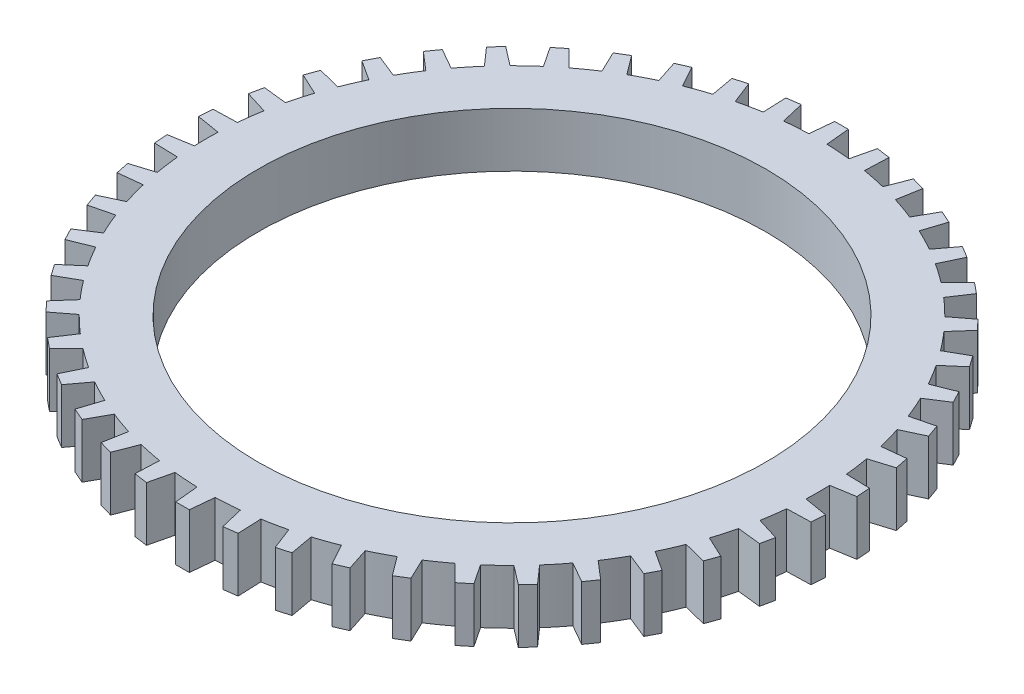
from build123d import *

# Parameters (mm, degrees)
CROQUIS1_R              = 14
SALIENTE_EXTRUIR1_DEPTH = 3


with BuildPart() as part:
    # Croquis1 → Saliente-Extruir1 (new body)
    with BuildSketch(Plane(origin=(0, 0, 0), x_dir=(1, 0, 0), z_dir=(0, 1, 0))):
        with BuildLine():
            Line((-0.5, 16.868356129), (-0.375, 18.168356129))
            Line((-0.375, 18.168356129), (0.375, 18.168356129))
            Line((0.375, 18.168356129), (0.5, 16.868356129))
            ThreePointArc((0.5, 16.868356129), (1.151642919, 16.836423524), (1.801564557, 16.779326674))
            Line((1.801564557, 16.779326674), (2.102416944, 18.050197573))
            Line((2.102416944, 18.050197573), (2.845431403, 17.948072586))
            Line((2.845431403, 17.948072586), (2.792250503, 16.643160025))
            ThreePointArc((2.792250503, 16.643160025), (3.433475829, 16.52279281), (4.069569375, 16.377730111))
            Line((4.069569375, 16.377730111), (4.540669838, 17.595797989))
            Line((4.540669838, 17.595797989), (5.262857804, 17.39345041))
            Line((5.262857804, 17.39345041), (5.032486662, 16.10793334))
            ThreePointArc((5.032486662, 16.10793334), (5.65134958, 15.901373727), (6.261765815, 15.671047424))
            Line((6.261765815, 15.671047424), (6.894338644, 16.81362198))
            Line((6.894338644, 16.81362198), (7.582247121, 16.514821163))
            Line((7.582247121, 16.514821163), (7.178977116, 15.272646334))
            ThreePointArc((7.178977116, 15.272646334), (7.763949382, 14.983742139), (8.337317406, 14.672442774))
            Line((8.337317406, 14.672442774), (9.119578966, 15.718240007))
            Line((9.119578966, 15.718240007), (9.76039352, 15.328552044))
            Line((9.76039352, 15.328552044), (9.19173681, 14.152858824))
            ThreePointArc((9.19173681, 14.152858824), (9.731921496, 13.786991785), (10.257560548, 13.400518277))
            Line((10.257560548, 13.400518277), (11.174938787, 14.330056962))
            Line((11.174938787, 14.330056962), (11.756722255, 13.856741004))
            Line((11.756722255, 13.856741004), (11.033271839, 12.769430333))
            ThreePointArc((11.033271839, 12.769430333), (11.518606327, 12.33341586), (11.986724746, 11.878967479))
            Line((11.986724746, 11.878967479), (13.022130642, 12.67493207))
            Line((13.022130642, 12.67493207), (13.5340455, 12.126805096))
            Line((13.5340455, 12.126805096), (12.669277889, 11.148131515))
            ThreePointArc((12.669277889, 11.148131515), (13.090721316, 10.650091734), (13.492598941, 10.136133993))
            Line((13.492598941, 10.136133993), (14.626744842, 10.783697175))
            Line((14.626744842, 10.783697175), (15.059255084, 10.170969755))
            Line((15.059255084, 10.170969755), (14.069279263, 9.3191641))
            ThreePointArc((14.069279263, 9.3191641), (14.418980935, 8.768376549), (14.747131547, 8.204483508))
            Line((14.747131547, 8.204483508), (15.958890461, 8.691582405))
            Line((15.958890461, 8.691582405), (16.303939239, 8.025668491))
            Line((16.303939239, 8.025668491), (15.207196585, 7.31659829))
            ThreePointArc((15.207196585, 7.31659829), (15.478642221, 6.723323099), (15.726952995, 6.11999902))
            Line((15.726952995, 6.11999902), (16.993752145, 6.4375599))
            Line((16.993752145, 6.4375599), (17.244911854, 5.730864208))
            Line((17.244911854, 5.730864208), (16.061832607, 5.177738097))
            ThreePointArc((16.061832607, 5.177738097), (16.249965689, 4.553026861), (16.413811065, 3.921510529))
            Line((16.413811065, 3.921510529), (17.71205238, 4.063617835))
            Line((17.71205238, 4.063617835), (17.86464439, 3.329304769))
            Line((17.86464439, 3.329304769), (16.617267078, 2.942426441))
            ThreePointArc((16.617267078, 2.942426441), (16.718583043, 2.297916347), (16.794910891, 1.649971716))
            Line((16.794910891, 1.649971716), (18.100410592, 1.613978258))
            Line((18.100410592, 1.613978258), (18.151592403, 0.865726681))
            Line((18.151592403, 0.865726681), (16.863153304, 0.652302947))
            ThreePointArc((16.863153304, 0.652302947), (16.875764827, 0), (16.863153304, -0.652302947))
            Line((16.863153304, -0.652302947), (18.151592403, -0.865726681))
            Line((18.151592403, -0.865726681), (18.100410592, -1.613978258))
            Line((18.100410592, -1.613978258), (16.794910891, -1.649971716))
            ThreePointArc((16.794910891, -1.649971716), (16.718583043, -2.297916347), (16.617267078, -2.942426441))
            Line((16.617267078, -2.942426441), (17.86464439, -3.329304769))
            Line((17.86464439, -3.329304769), (17.71205238, -4.063617835))
            Line((17.71205238, -4.063617835), (16.413811065, -3.921510529))
            ThreePointArc((16.413811065, -3.921510529), (16.249965689, -4.553026861), (16.061832607, -5.177738097))
            Line((16.061832607, -5.177738097), (17.244911854, -5.730864208))
            Line((17.244911854, -5.730864208), (16.993752145, -6.4375599))
            Line((16.993752145, -6.4375599), (15.726952995, -6.11999902))
            ThreePointArc((15.726952995, -6.11999902), (15.478642221, -6.723323099), (15.207196585, -7.31659829))
            Line((15.207196585, -7.31659829), (16.303939239, -8.025668491))
            Line((16.303939239, -8.025668491), (15.958890461, -8.691582405))
            Line((15.958890461, -8.691582405), (14.747131547, -8.204483508))
            ThreePointArc((14.747131547, -8.204483508), (14.418980935, -8.768376549), (14.069279263, -9.3191641))
            Line((14.069279263, -9.3191641), (15.059255084, -10.170969755))
            Line((15.059255084, -10.170969755), (14.626744842, -10.783697175))
            Line((14.626744842, -10.783697175), (13.492598941, -10.136133993))
            ThreePointArc((13.492598941, -10.136133993), (13.090721316, -10.650091734), (12.669277889, -11.148131515))
            Line((12.669277889, -11.148131515), (13.5340455, -12.126805096))
            Line((13.5340455, -12.126805096), (13.022130642, -12.67493207))
            Line((13.022130642, -12.67493207), (11.986724746, -11.878967479))
            ThreePointArc((11.986724746, -11.878967479), (11.518606327, -12.33341586), (11.033271839, -12.769430333))
            Line((11.033271839, -12.769430333), (11.756722255, -13.856741004))
            Line((11.756722255, -13.856741004), (11.174938787, -14.330056962))
            Line((11.174938787, -14.330056962), (10.257560548, -13.400518277))
            ThreePointArc((10.257560548, -13.400518277), (9.731921496, -13.786991785), (9.19173681, -14.152858824))
            Line((9.19173681, -14.152858824), (9.76039352, -15.328552044))
            Line((9.76039352, -15.328552044), (9.119578966, -15.718240007))
            Line((9.119578966, -15.718240007), (8.337317406, -14.672442774))
            ThreePointArc((8.337317406, -14.672442774), (7.763949382, -14.983742139), (7.178977116, -15.272646334))
            Line((7.178977116, -15.272646334), (7.582247121, -16.514821163))
            Line((7.582247121, -16.514821163), (6.894338644, -16.81362198))
            Line((6.894338644, -16.81362198), (6.261765815, -15.671047424))
            ThreePointArc((6.261765815, -15.671047424), (5.65134958, -15.901373727), (5.032486662, -16.10793334))
            Line((5.032486662, -16.10793334), (5.262857804, -17.39345041))
            Line((5.262857804, -17.39345041), (4.540669838, -17.595797989))
            Line((4.540669838, -17.595797989), (4.069569375, -16.377730111))
            ThreePointArc((4.069569375, -16.377730111), (3.433475829, -16.52279281), (2.792250503, -16.643160025))
            Line((2.792250503, -16.643160025), (2.845431403, -17.948072586))
            Line((2.845431403, -17.948072586), (2.102416944, -18.050197573))
            Line((2.102416944, -18.050197573), (1.801564557, -16.779326674))
            ThreePointArc((1.801564557, -16.779326674), (1.151642919, -16.836423524), (0.5, -16.868356129))
            Line((0.5, -16.868356129), (0.375, -18.168356129))
            Line((0.375, -18.168356129), (-0.375, -18.168356129))
            Line((-0.375, -18.168356129), (-0.5, -16.868356129))
            ThreePointArc((-0.5, -16.868356129), (-1.151642919, -16.836423524), (-1.801564557, -16.779326674))
            Line((-1.801564557, -16.779326674), (-2.102416944, -18.050197573))
            Line((-2.102416944, -18.050197573), (-2.845431403, -17.948072586))
            Line((-2.845431403, -17.948072586), (-2.792250503, -16.643160025))
            ThreePointArc((-2.792250503, -16.643160025), (-3.433475829, -16.52279281), (-4.069569375, -16.377730111))
            Line((-4.069569375, -16.377730111), (-4.540669838, -17.595797989))
            Line((-4.540669838, -17.595797989), (-5.262857804, -17.39345041))
            Line((-5.262857804, -17.39345041), (-5.032486662, -16.10793334))
            ThreePointArc((-5.032486662, -16.10793334), (-5.65134958, -15.901373727), (-6.261765815, -15.671047424))
            Line((-6.261765815, -15.671047424), (-6.894338644, -16.81362198))
            Line((-6.894338644, -16.81362198), (-7.582247121, -16.514821163))
            Line((-7.582247121, -16.514821163), (-7.178977116, -15.272646334))
            ThreePointArc((-7.178977116, -15.272646334), (-7.763949382, -14.983742139), (-8.337317406, -14.672442774))
            Line((-8.337317406, -14.672442774), (-9.119578966, -15.718240007))
            Line((-9.119578966, -15.718240007), (-9.76039352, -15.328552044))
            Line((-9.76039352, -15.328552044), (-9.19173681, -14.152858824))
            ThreePointArc((-9.19173681, -14.152858824), (-9.731921496, -13.786991785), (-10.257560548, -13.400518277))
            Line((-10.257560548, -13.400518277), (-11.174938787, -14.330056962))
            Line((-11.174938787, -14.330056962), (-11.756722255, -13.856741004))
            Line((-11.756722255, -13.856741004), (-11.033271839, -12.769430333))
            ThreePointArc((-11.033271839, -12.769430333), (-11.518606327, -12.33341586), (-11.986724746, -11.878967479))
            Line((-11.986724746, -11.878967479), (-13.022130642, -12.67493207))
            Line((-13.022130642, -12.67493207), (-13.5340455, -12.126805096))
            Line((-13.5340455, -12.126805096), (-12.669277889, -11.148131515))
            ThreePointArc((-12.669277889, -11.148131515), (-13.090721316, -10.650091734), (-13.492598941, -10.136133993))
            Line((-13.492598941, -10.136133993), (-14.626744842, -10.783697175))
            Line((-14.626744842, -10.783697175), (-15.059255084, -10.170969755))
            Line((-15.059255084, -10.170969755), (-14.069279263, -9.3191641))
            ThreePointArc((-14.069279263, -9.3191641), (-14.418980935, -8.768376549), (-14.747131547, -8.204483508))
            Line((-14.747131547, -8.204483508), (-15.958890461, -8.691582405))
            Line((-15.958890461, -8.691582405), (-16.303939239, -8.025668491))
            Line((-16.303939239, -8.025668491), (-15.207196585, -7.31659829))
            ThreePointArc((-15.207196585, -7.31659829), (-15.478642221, -6.723323099), (-15.726952995, -6.11999902))
            Line((-15.726952995, -6.11999902), (-16.993752145, -6.4375599))
            Line((-16.993752145, -6.4375599), (-17.244911854, -5.730864208))
            Line((-17.244911854, -5.730864208), (-16.061832607, -5.177738097))
            ThreePointArc((-16.061832607, -5.177738097), (-16.249965689, -4.553026861), (-16.413811065, -3.921510529))
            Line((-16.413811065, -3.921510529), (-17.71205238, -4.063617835))
            Line((-17.71205238, -4.063617835), (-17.86464439, -3.329304769))
            Line((-17.86464439, -3.329304769), (-16.617267078, -2.942426441))
            ThreePointArc((-16.617267078, -2.942426441), (-16.718583043, -2.297916347), (-16.794910891, -1.649971716))
            Line((-16.794910891, -1.649971716), (-18.100410592, -1.613978258))
            Line((-18.100410592, -1.613978258), (-18.151592403, -0.865726681))
            Line((-18.151592403, -0.865726681), (-16.863153304, -0.652302947))
            ThreePointArc((-16.863153304, -0.652302947), (-16.875764827, 0), (-16.863153304, 0.652302947))
            Line((-16.863153304, 0.652302947), (-18.151592403, 0.865726681))
            Line((-18.151592403, 0.865726681), (-18.100410592, 1.613978258))
            Line((-18.100410592, 1.613978258), (-16.794910891, 1.649971716))
            ThreePointArc((-16.794910891, 1.649971716), (-16.718583043, 2.297916347), (-16.617267078, 2.942426441))
            Line((-16.617267078, 2.942426441), (-17.86464439, 3.329304769))
            Line((-17.86464439, 3.329304769), (-17.71205238, 4.063617835))
            Line((-17.71205238, 4.063617835), (-16.413811065, 3.921510529))
            ThreePointArc((-16.413811065, 3.921510529), (-16.249965689, 4.553026861), (-16.061832607, 5.177738097))
            Line((-16.061832607, 5.177738097), (-17.244911854, 5.730864208))
            Line((-17.244911854, 5.730864208), (-16.993752145, 6.4375599))
            Line((-16.993752145, 6.4375599), (-15.726952995, 6.11999902))
            ThreePointArc((-15.726952995, 6.11999902), (-15.478642221, 6.723323099), (-15.207196585, 7.31659829))
            Line((-15.207196585, 7.31659829), (-16.303939239, 8.025668491))
            Line((-16.303939239, 8.025668491), (-15.958890461, 8.691582405))
            Line((-15.958890461, 8.691582405), (-14.747131547, 8.204483508))
            ThreePointArc((-14.747131547, 8.204483508), (-14.418980935, 8.768376549), (-14.069279263, 9.3191641))
            Line((-14.069279263, 9.3191641), (-15.059255084, 10.170969755))
            Line((-15.059255084, 10.170969755), (-14.626744842, 10.783697175))
            Line((-14.626744842, 10.783697175), (-13.492598941, 10.136133993))
            ThreePointArc((-13.492598941, 10.136133993), (-13.090721316, 10.650091734), (-12.669277889, 11.148131515))
            Line((-12.669277889, 11.148131515), (-13.5340455, 12.126805096))
            Line((-13.5340455, 12.126805096), (-13.022130642, 12.67493207))
            Line((-13.022130642, 12.67493207), (-11.986724746, 11.878967479))
            ThreePointArc((-11.986724746, 11.878967479), (-11.518606327, 12.33341586), (-11.033271839, 12.769430333))
            Line((-11.033271839, 12.769430333), (-11.756722255, 13.856741004))
            Line((-11.756722255, 13.856741004), (-11.174938787, 14.330056962))
            Line((-11.174938787, 14.330056962), (-10.257560548, 13.400518277))
            ThreePointArc((-10.257560548, 13.400518277), (-9.731921496, 13.786991785), (-9.19173681, 14.152858824))
            Line((-9.19173681, 14.152858824), (-9.76039352, 15.328552044))
            Line((-9.76039352, 15.328552044), (-9.119578966, 15.718240007))
            Line((-9.119578966, 15.718240007), (-8.337317406, 14.672442774))
            ThreePointArc((-8.337317406, 14.672442774), (-7.763949382, 14.983742139), (-7.178977116, 15.272646334))
            Line((-7.178977116, 15.272646334), (-7.582247121, 16.514821163))
            Line((-7.582247121, 16.514821163), (-6.894338644, 16.81362198))
            Line((-6.894338644, 16.81362198), (-6.261765815, 15.671047424))
            ThreePointArc((-6.261765815, 15.671047424), (-5.65134958, 15.901373727), (-5.032486662, 16.10793334))
            Line((-5.032486662, 16.10793334), (-5.262857804, 17.39345041))
            Line((-5.262857804, 17.39345041), (-4.540669838, 17.595797989))
            Line((-4.540669838, 17.595797989), (-4.069569375, 16.377730111))
            ThreePointArc((-4.069569375, 16.377730111), (-3.433475829, 16.52279281), (-2.792250503, 16.643160025))
            Line((-2.792250503, 16.643160025), (-2.845431403, 17.948072586))
            Line((-2.845431403, 17.948072586), (-2.102416944, 18.050197573))
            Line((-2.102416944, 18.050197573), (-1.801564557, 16.779326674))
            ThreePointArc((-1.801564557, 16.779326674), (-1.151642919, 16.836423524), (-0.5, 16.868356129))
        make_face()
        with Locations(Location((0, 0, 0), (0, 0, 270))):
            Circle(CROQUIS1_R, mode=Mode.SUBTRACT)
    extrude(amount=SALIENTE_EXTRUIR1_DEPTH)


solid = part.part
